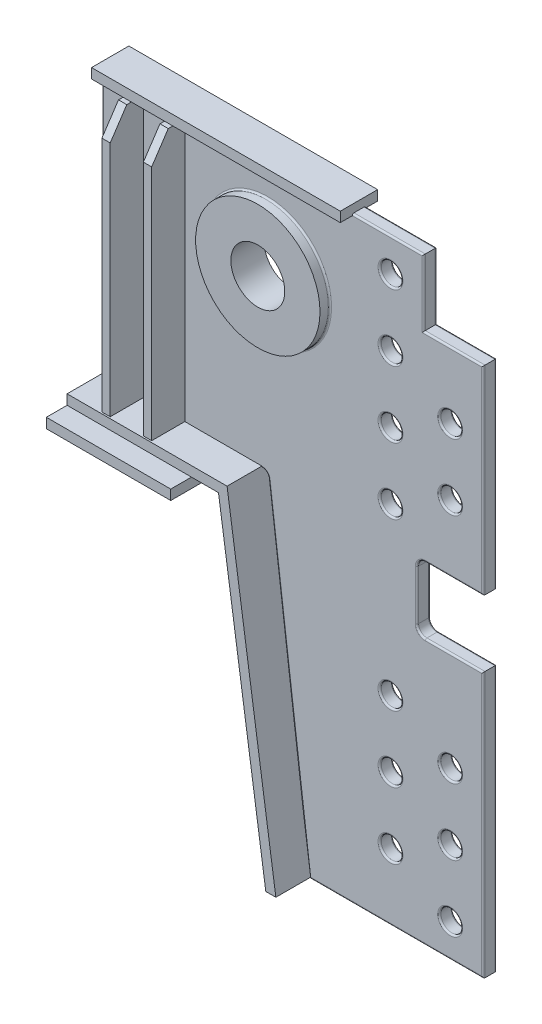
from build123d import *

# Parameters (mm, degrees)
SKETCH_1_R           = 13
SKETCH_1_R_2         = 37.5
EXTRUDE_1317_DEPTH   = 16
EXTRUDE_1_DEPTH      = 12
EXTRUDE_1_DEPTH_BACK = 28
SKETCH_2_R           = 75
SKETCH_2_R_2         = 32.5
FILLET_1_R           = 2
FILLET_2_R           = 2
EXTRUDE_2_DEPTH      = 40
EXTRUDE_2_DEPTH_BACK = 56
SKETCH_3_W           = 10
SKETCH_3_H           = 316
CUT_EXTRUDE_1_DEPTH  = 836.425640018
CUT_EXTRUDE_2_DEPTH  = 836.425640018
EXTRUDE_5_DEPTH      = 42
EXTRUDE_5_DEPTH_BACK = 58
EXTRUDE_6_DEPTH      = 14.5
EXTRUDE_6_DEPTH_BACK = 30.5
SKETCH_7_W           = 300
SKETCH_7_H           = 12
SKETCH_8_W           = 150
SKETCH_8_H           = 150
EXTRUDE_7_DEPTH      = 12


with BuildPart() as part:
    # 草图1 → Extrude 1317 (new body)
    with BuildSketch(Plane.XY):
        with BuildLine():
            Line((0, -320), (-70, -320))
            ThreePointArc((-70, -320), (-77.071067812, -322.928932188), (-80, -330))
            Line((-80, -330), (-80, -390))
            ThreePointArc((-80, -390), (-77.071067812, -397.071067812), (-70, -400))
            Line((-70, -400), (0, -400))
            Line((0, -400), (0, -720))
            Line((0, -720), (-210, -720))
            Line((-210, -720), (-259.124034735, -327.007722123))
            ThreePointArc((-259.124034735, -327.007722123), (-261.767837242, -322.002574593), (-267.062257748, -320))
            Line((-267.062257748, -320), (-460, -320))
            Line((-460, -320), (-460, 0))
            Line((-460, 0), (-72, 0))
            Line((-72, 0), (-72, -80))
            Line((-72, -80), (0, -80))
            Line((0, -80), (0, -320))
        make_face()
        with Locations((-112, -40)):
            Circle(SKETCH_1_R, mode=Mode.SUBTRACT)
        with Locations((-112, -120)):
            Circle(SKETCH_1_R, mode=Mode.SUBTRACT)
        with Locations((-112, -200)):
            Circle(SKETCH_1_R, mode=Mode.SUBTRACT)
        with Locations((-112, -280)):
            Circle(SKETCH_1_R, mode=Mode.SUBTRACT)
        with Locations((-40, -160)):
            Circle(SKETCH_1_R, mode=Mode.SUBTRACT)
        with Locations((-40, -240)):
            Circle(SKETCH_1_R, mode=Mode.SUBTRACT)
        with Locations((-40, -680)):
            Circle(SKETCH_1_R, mode=Mode.SUBTRACT)
        with Locations((-40, -600)):
            Circle(SKETCH_1_R, mode=Mode.SUBTRACT)
        with Locations((-40, -520)):
            Circle(SKETCH_1_R, mode=Mode.SUBTRACT)
        with Locations((-112, -640)):
            Circle(SKETCH_1_R, mode=Mode.SUBTRACT)
        with Locations((-112, -560)):
            Circle(SKETCH_1_R, mode=Mode.SUBTRACT)
        with Locations((-112, -480)):
            Circle(SKETCH_1_R, mode=Mode.SUBTRACT)
        with Locations((-260, -110)):
            Circle(SKETCH_1_R_2, mode=Mode.SUBTRACT)
    extrude(amount=EXTRUDE_1317_DEPTH)

    # 草图2 → 凸台-拉伸1 (add, two sides: drawn at the far end of the back side and taken through both)
    with BuildSketch(Plane.XY.offset(16).offset(-EXTRUDE_1_DEPTH_BACK)):
        with Locations((-260, -110)):
            Circle(SKETCH_2_R)
        with Locations((-260, -110)):
            Circle(SKETCH_2_R_2, mode=Mode.SUBTRACT)
    extrude(amount=EXTRUDE_1_DEPTH + EXTRUDE_1_DEPTH_BACK)

    # 圆角1
    fillet_1_edges = [part.edges().sort_by_distance(p)[0] for p in [
        (-105, -720, 16),
        (0, -560, 16),
        (-35, -400, 16),
        (-77.071067812, -397.071067812, 16),
        (-80, -360, 16),
        (-77.071067812, -322.928932188, 16),
        (-35, -320, 16),
        (0, -200, 16),
        (-36, -80, 16),
        (-125, -40, 16),
        (-72, -40, 16),
        (-261.767837242, -322.002574593, 16),
        (-266, 0, 16),
        (-125, -120, 16),
        (-460, -160, 16),
        (-125, -200, 16),
        (-363.531128874, -320, 16),
        (-125, -280, 16),
        (-53, -160, 16),
        (-53, -240, 16),
        (-53, -680, 16),
        (-53, -600, 16),
        (-53, -520, 16),
        (-234.562017367, -523.503861062, 16),
        (-125, -640, 16),
        (-125, -560, 16),
        (-125, -480, 16),
        (-335, -110, 16),
    ]]
    fillet(fillet_1_edges, radius=FILLET_1_R)

    # 圆角2
    fillet_2_edges = [part.edges().sort_by_distance(p)[0] for p in [
        (-363.531128874, -320, 0),
        (-460, -160, 0),
        (-266, 0, 0),
        (-72, -40, 0),
        (-36, -80, 0),
        (0, -200, 0),
        (-35, -320, 0),
        (-77.071067812, -322.928932188, 0),
        (-80, -360, 0),
        (-77.071067812, -397.071067812, 0),
        (-35, -400, 0),
        (0, -560, 0),
        (-105, -720, 0),
        (-234.562017367, -523.503861062, 0),
        (-261.767837242, -322.002574593, 0),
        (-125, -40, 0),
        (-125, -120, 0),
        (-125, -200, 0),
        (-125, -280, 0),
        (-53, -160, 0),
        (-53, -240, 0),
        (-53, -680, 0),
        (-53, -600, 0),
        (-53, -520, 0),
        (-125, -640, 0),
        (-125, -560, 0),
        (-125, -480, 0),
        (-335, -110, 0),
    ]]
    fillet(fillet_2_edges, radius=FILLET_2_R)

    # 草图3 → 凸台-拉伸2 (add, two sides: drawn at the far end of the back side and taken through both)
    with BuildSketch(Plane.XY.offset(16).offset(-EXTRUDE_2_DEPTH_BACK)):
        with Locations((-415, -160)):
            Rectangle(SKETCH_3_W, SKETCH_3_H)
        with Locations((-365, -160)):
            Rectangle(SKETCH_3_W, SKETCH_3_H)
    extrude(amount=EXTRUDE_2_DEPTH + EXTRUDE_2_DEPTH_BACK)

    # 草图4 → 切除-拉伸1 (cut, through all)
    with BuildSketch(Plane.ZY.offset(420)):
        Polygon((-20, -2), (-45.5, -32), (-45.5, -2), align=None)
    extrude(amount=-CUT_EXTRUDE_1_DEPTH, mode=Mode.SUBTRACT)

    # 草图5 → 切除-拉伸2 (cut, through all)
    with BuildSketch(Plane.ZY.offset(420)):
        Polygon((36, -2), (56, -32), (56, -2), align=None)
    extrude(amount=-CUT_EXTRUDE_2_DEPTH, mode=Mode.SUBTRACT)

    # 草图6 → 凸台-拉伸5 (add, two sides: drawn at the far end of the back side and taken through both)
    with BuildSketch(Plane.XY.offset(16).offset(-EXTRUDE_5_DEPTH_BACK)):
        Polygon((-267.062257748, -318), (-460, -318), (-460, -330), (-277.426505546, -330), (-220.363518026, -718), (-208.234435563, -718), align=None)
    extrude(amount=EXTRUDE_5_DEPTH + EXTRUDE_5_DEPTH_BACK)

    # 草图7 → 凸台-拉伸6 (add, two sides: drawn at the far end of the back side and taken through both)
    with BuildSketch(Plane(origin=(0, 0, 0), x_dir=(-1, 0, 0), z_dir=(0, 0, -1)).offset(-EXTRUDE_6_DEPTH_BACK)):
        with Locations((308, 4)):
            Rectangle(SKETCH_7_W, SKETCH_7_H)
    extrude(amount=EXTRUDE_6_DEPTH + EXTRUDE_6_DEPTH_BACK)

    # 草图8 → 凸台-拉伸7 (add)
    with BuildSketch(Plane.XZ.offset(330)):
        with Locations((-385, 8)):
            Rectangle(SKETCH_8_W, SKETCH_8_H)
    extrude(amount=EXTRUDE_7_DEPTH)


solid = part.part
